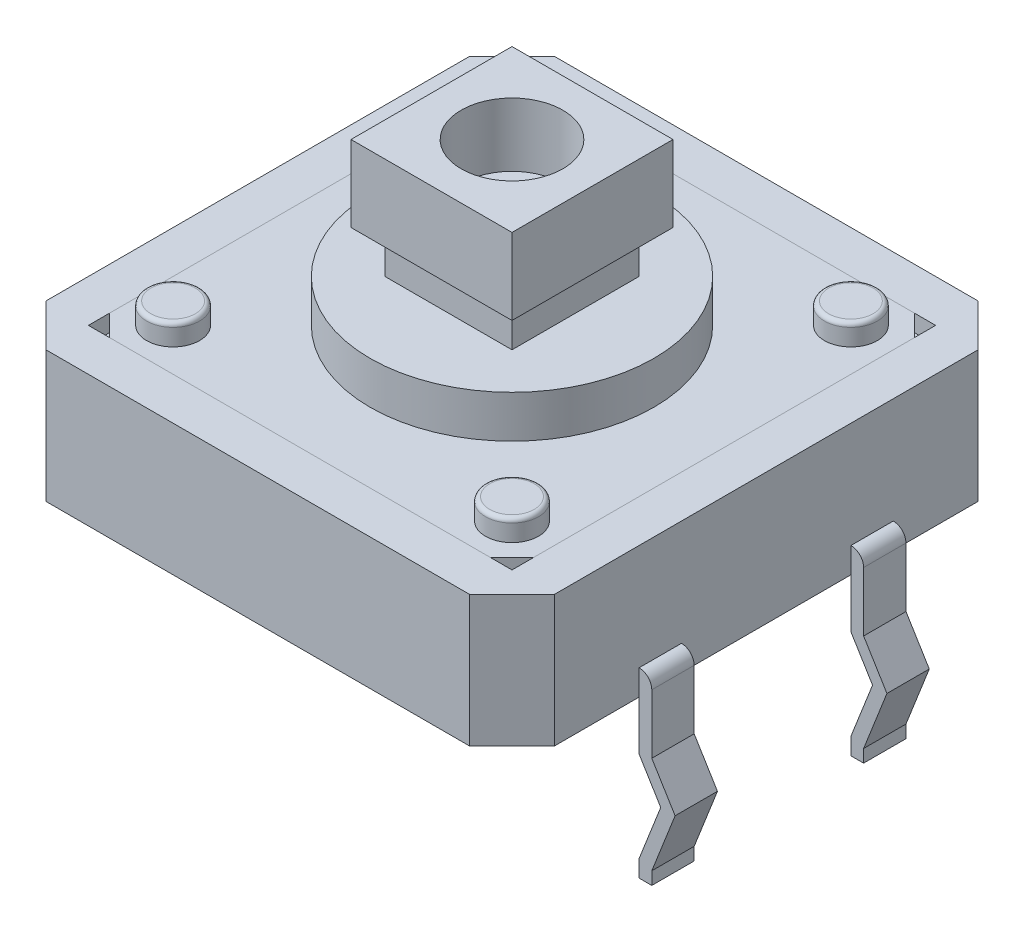
from build123d import *

# Parameters (mm, degrees)
BOSS_EXTRUDE1_DEPTH      = 3.1
SKETCH2_W                = 10
SKETCH2_H                = 10
CUT_EXTRUDE1_DEPTH       = 0.4
SKETCH3_R                = 0.625
BOSS_EXTRUDE2_DEPTH      = 0.9
FILLET1_R                = 0.1
SKETCH4_R                = 3.35
BOSS_EXTRUDE3_DEPTH      = 0.4
BOSS_EXTRUDE4_DEPTH      = 3
BOSS_EXTRUDE4_DEPTH_BACK = 3
CUT_EXTRUDE2_DEPTH       = 10.829165784
CUT_EXTRUDE2_DEPTH_BACK  = 10.829165784
SKETCH6_W                = 0.85
SKETCH6_H                = 4
SKETCH7_R                = 3.35
BOSS_EXTRUDE5_DEPTH      = 1.4
SKETCH8_W                = 3
SKETCH8_H                = 3
BOSS_EXTRUDE6_DEPTH      = 1
SKETCH9_W                = 3.8
SKETCH9_H                = 3.8
BOSS_EXTRUDE7_DEPTH      = 1.8
SKETCH11_R               = 1.2
CUT_EXTRUDE3_DEPTH       = 1.5
BOSS_EXTRUDE8_DEPTH      = 0.2


with BuildPart() as part:
    # Sketch1 → Boss-Extrude1 (new body)
    with BuildSketch(Plane(origin=(0, 0, 0), x_dir=(1, 0, 0), z_dir=(0, 1, 0))):
        Polygon((-5, 6), (-6, 5), (-6, -5), (-5, -6), (5, -6), (6, -5), (6, 5), (5, 6), align=None)
    extrude(amount=BOSS_EXTRUDE1_DEPTH)

    # Sketch2 → Cut-Extrude1 (cut)
    with BuildSketch(Plane(origin=(0, 3.1, 0), x_dir=(1, 0, 0), z_dir=(0, 1, 0))):
        Rectangle(SKETCH2_W, SKETCH2_H)
    extrude(amount=-CUT_EXTRUDE1_DEPTH, mode=Mode.SUBTRACT)

    # Sketch3 → Boss-Extrude2 (add)
    with BuildSketch(Plane(origin=(0, 2.7, 0), x_dir=(1, 0, 0), z_dir=(0, 1, 0))):
        with Locations(Location((-4, 4, 0), (0, 0, 270))):
            Circle(SKETCH3_R)
        with Locations(Location((4, 4, 0), (0, 0, 270))):
            Circle(SKETCH3_R)
        with Locations(Location((-4, -4, 0), (0, 0, 270))):
            Circle(SKETCH3_R)
        with Locations(Location((4, -4, 0), (0, 0, 270))):
            Circle(SKETCH3_R)
    extrude(amount=BOSS_EXTRUDE2_DEPTH)

    # Fillet1
    fillet1_edges = [part.edges().sort_by_distance(p)[0] for p in [
        (-4, 3.6, -4.625),
        (4, 3.6, -4.625),
        (-4, 3.6, 3.375),
        (4, 3.6, 3.375),
    ]]
    fillet(fillet1_edges, radius=FILLET1_R)

    # Sketch12 → Boss-Extrude8 (add)
    with BuildSketch(Plane.XZ):
        Polygon((3, 5.5), (3, 3.7), (5.5, 3.7), (5.5, 4.792893219), (4.792893219, 5.5), align=None)
        Polygon((4.792893219, -5.5), (5.5, -4.792893219), (5.5, -3.7), (3, -3.7), (3, -5.5), align=None)
        Polygon((-3, -5.5), (-3, -3.7), (-5.5, -3.7), (-5.5, -4.792893219), (-4.792893219, -5.5), align=None)
        Polygon((-4.792893219, 5.5), (-5.5, 4.792893219), (-5.5, 3.7), (-3, 3.7), (-3, 5.5), align=None)
    extrude(amount=BOSS_EXTRUDE8_DEPTH)


with BuildPart() as body_2:
    # Sketch4 → Boss-Extrude3 (new body)
    with BuildSketch(Plane(origin=(0, 2.7, 0), x_dir=(1, 0, 0), z_dir=(0, 1, 0))):
        Polygon((4.5, -5), (-4.5, -5), (-5, -4.5), (-5, 4.5), (-4.5, 5), (4.5, 5), (5, 4.5), (5, -4.5), align=None)
        with Locations(Location((0, 0, 0), (0, 0, 270))):
            Circle(SKETCH4_R, mode=Mode.SUBTRACT)
    extrude(amount=BOSS_EXTRUDE3_DEPTH)


with BuildPart() as body_3:
    # Sketch5 → Boss-Extrude4 (new, two sides: drawn at the far end of the back side and taken through both)
    with BuildSketch(Plane.XY.offset(-BOSS_EXTRUDE4_DEPTH_BACK)):
        with BuildLine():
            Line((6, 0.6), (6, -1.164285714))
            Line((6, -1.164285714), (6.510714286, -2))
            Line((6.510714286, -2), (6, -3.3))
            Line((6, -3.3), (6, -3.7))
            Line((6, -3.7), (6.3, -3.7))
            Line((6.3, -3.7), (6.3, -3.4))
            Line((6.3, -3.4), (6.85, -2))
            Line((6.85, -2), (6.3, -1.1))
            Line((6.3, -1.1), (6.3, 0.3))
            ThreePointArc((6.3, 0.3), (6.212132034, 0.512132034), (6, 0.6))
        make_face()
    extrude(amount=BOSS_EXTRUDE4_DEPTH + BOSS_EXTRUDE4_DEPTH_BACK)

    # Sketch6 → Cut-Extrude2 (cut, two sides: drawn at the far end of the back side and taken through both)
    with BuildSketch(Plane(origin=(0, 0, 0), x_dir=(1, 0, 0), z_dir=(0, 1, 0)).offset(-CUT_EXTRUDE2_DEPTH_BACK)):
        with Locations((6.425, 0)):
            Rectangle(SKETCH6_W, SKETCH6_H)
    extrude(amount=CUT_EXTRUDE2_DEPTH + CUT_EXTRUDE2_DEPTH_BACK, mode=Mode.SUBTRACT)


with BuildPart() as cut_extrude2_piece_1:
    # of the separate pieces the step leaves, piece 1, a body of its own (cut_extrude2_pieces)
    add(body_3.part.solids().sort_by_distance((6, 0.6, -2))[0])


with BuildPart() as cut_extrude2_piece_2:
    # of the separate pieces the step leaves, piece 2, a body of its own (cut_extrude2_pieces)
    add(body_3.part.solids().sort_by_distance((6, 0.6, 3))[0])


with BuildPart() as body_5:
    # Sketch7 → Boss-Extrude5 (new body)
    with BuildSketch(Plane(origin=(0, 2.7, 0), x_dir=(1, 0, 0), z_dir=(0, 1, 0))):
        with Locations(Location((0, 0, 0), (0, 0, 270))):
            Circle(SKETCH7_R)
    extrude(amount=BOSS_EXTRUDE5_DEPTH)

    # Sketch8 → Boss-Extrude6 (add)
    with BuildSketch(Plane(origin=(0, 4.1, 0), x_dir=(1, 0, 0), z_dir=(0, 1, 0))):
        Rectangle(SKETCH8_W, SKETCH8_H)
    extrude(amount=BOSS_EXTRUDE6_DEPTH)

    # Sketch9 → Boss-Extrude7 (add)
    with BuildSketch(Plane(origin=(0, 5.1, 0), x_dir=(1, 0, 0), z_dir=(0, 1, 0))):
        Rectangle(SKETCH9_W, SKETCH9_H)
    extrude(amount=BOSS_EXTRUDE7_DEPTH)

    # Sketch11 → Cut-Extrude3 (cut)
    with BuildSketch(Plane(origin=(0, 6.9, 0), x_dir=(1, 0, 0), z_dir=(0, 1, 0))):
        with Locations(Location((0, 0, 0), (0, 0, 270))):
            Circle(SKETCH11_R)
    extrude(amount=-CUT_EXTRUDE3_DEPTH, mode=Mode.SUBTRACT)


solid = Compound([part.part, body_2.part, cut_extrude2_piece_1.part, cut_extrude2_piece_2.part, body_5.part])
